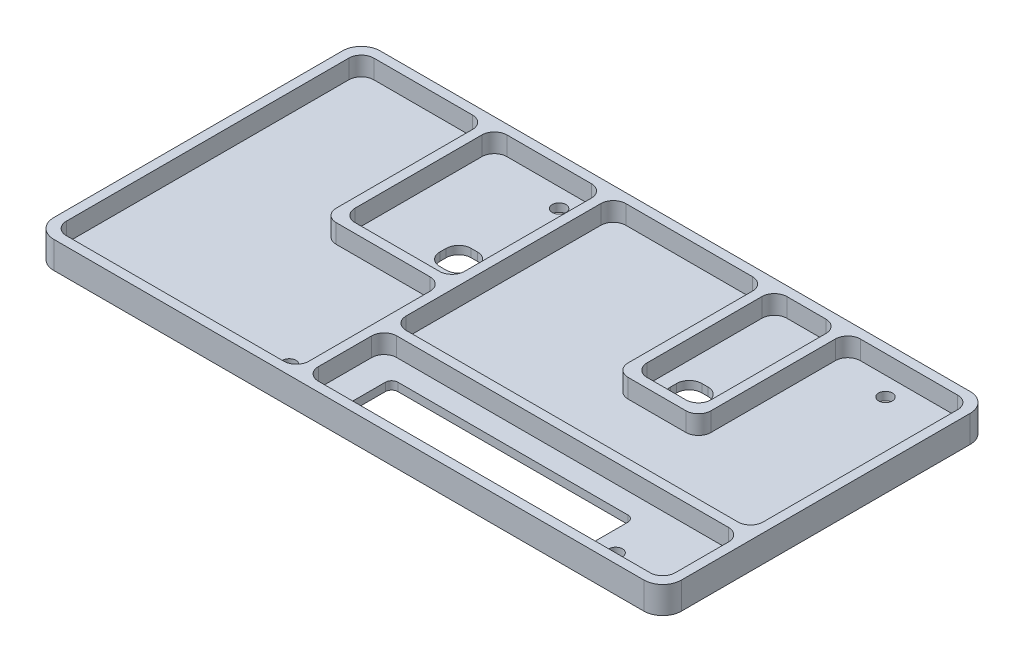
from build123d import *

# Parameters (mm, degrees)
SKETCH_1_W          = 100
SKETCH_1_H          = 52
EXTRUDE_1_DEPTH     = 8.6
SKETCH_2_W          = 97
SKETCH_2_H          = 49
CUT_EXTRUDE_1_DEPTH = 3
SKETCH_3_R          = 1.1
SKETCH_3_W          = 38.632034186
SKETCH_3_H          = 7.399361665
SKETCH_3_W_2        = 5
SKETCH_3_H_2        = 5
CUT_EXTRUDE_2_DEPTH = 61.603041755
FILLET_1_R          = 2
SKETCH_4_W          = 1.5
SKETCH_4_H          = 6.8
CUT_EXTRUDE_3_DEPTH = 1
SKETCH_5_W          = 97
SKETCH_5_H          = 49
CUT_EXTRUDE_4_DEPTH = 3
EXTRUDE_2_DEPTH     = 3
FILLET_2_R          = 3
FILLET_3_R          = 2
FILLET_5_R          = 1
SKETCH_9_W          = 52
SKETCH_9_H          = 4.3
CUT_EXTRUDE_5_DEPTH = 106.341399486


with BuildPart() as part:
    # 草图1 → 凸台-拉伸1 (new body)
    with BuildSketch(Plane(origin=(0, 0, 0), x_dir=(1, 0, 0), z_dir=(0, 1, 0))):
        with Locations((1.17145908, 5.982033169)):
            Rectangle(SKETCH_1_W, SKETCH_1_H)
    extrude(amount=EXTRUDE_1_DEPTH)

    # 草图2 → 切除-拉伸1 (cut)
    with BuildSketch(Plane.XZ):
        with Locations((1.17145908, -5.982033169)):
            Rectangle(SKETCH_2_W, SKETCH_2_H)
    extrude(amount=-CUT_EXTRUDE_1_DEPTH, mode=Mode.SUBTRACT)

    # 草图3 → 切除-拉伸2 (cut, through all)
    with BuildSketch(Plane.XZ.offset(-3)):
        with Locations(Location((-12.82854092, 15.517966831, 0), (0, 0, 270))):
            Circle(SKETCH_3_R)
        with Locations(Location((39.17145908, 15.517966831, 0), (0, 0, 270))):
            Circle(SKETCH_3_R)
        with Locations(Location((39.17145908, -27.482033169, 0), (0, 0, 270))):
            Circle(SKETCH_3_R)
        with Locations(Location((-12.82854092, -27.482033169, 0), (0, 0, 270))):
            Circle(SKETCH_3_R)
        with Locations((16.615396969, 13.018709543)):
            Rectangle(SKETCH_3_W, SKETCH_3_H)
        with Locations((-13.82854092, -12.482033169)):
            Rectangle(SKETCH_3_W_2, SKETCH_3_H_2)
        with Locations((23.17145908, -12.21289677)):
            Rectangle(SKETCH_3_W_2, SKETCH_3_H_2)
    extrude(amount=-CUT_EXTRUDE_2_DEPTH, mode=Mode.SUBTRACT)

    # 圆角1
    fillet_1_edges = [part.edges().sort_by_distance(p)[0] for p in [
        (20.67145908, 5.8, -14.71289677),
        (20.67145908, 5.8, -9.71289677),
        (25.67145908, 5.8, -9.71289677),
        (25.67145908, 5.8, -14.71289677),
        (-16.32854092, 5.8, -14.982033169),
        (-16.32854092, 5.8, -9.982033169),
        (-11.32854092, 5.8, -9.982033169),
        (-11.32854092, 5.8, -14.982033169),
    ]]
    fillet(fillet_1_edges, radius=FILLET_1_R)

    # 草图4 → 切除-拉伸3 (cut)
    with BuildSketch(Plane.XZ):
        with Locations((50.42145908, 0.917966831)):
            Rectangle(SKETCH_4_W, SKETCH_4_H)
    extrude(amount=-CUT_EXTRUDE_3_DEPTH, mode=Mode.SUBTRACT)

    # 草图5 → 切除-拉伸4 (cut)
    with BuildSketch(Plane(origin=(0, 8.6, 0), x_dir=(1, 0, 0), z_dir=(0, 1, 0))):
        with Locations((1.17145908, 5.982033169)):
            Rectangle(SKETCH_5_W, SKETCH_5_H)
    extrude(amount=-CUT_EXTRUDE_4_DEPTH, mode=Mode.SUBTRACT)

    # 草图7 → 凸台-拉伸2 (add, through all)
    with BuildSketch(Plane(origin=(0, 5.6, 0), x_dir=(1, 0, 0), z_dir=(0, 1, 0))):
        Polygon((-8.68854092, -18.517966831), (-8.68854092, 4.782033169), (-27.62854092, 4.782033169), (-27.62854092, 30.482033169), (-26.12854092, 30.482033169), (-26.12854092, 6.282033169), (-8.68854092, 6.282033169), (-8.68854092, 30.482033169), (-7.18854092, 30.482033169), (-7.18854092, -4.517966831), (49.67145908, -4.517966831), (49.67145908, -6.017966831), (-7.18854092, -6.017966831), (-7.18854092, -18.517966831), align=None)
        Polygon((16.97145908, 30.482033169), (16.97145908, 6.682033169), (30.17145908, 6.682033169), (30.17145908, 30.482033169), (28.67145908, 30.482033169), (28.67145908, 8.182033169), (18.47145908, 8.182033169), (18.47145908, 30.482033169), align=None)
    extrude(amount=EXTRUDE_2_DEPTH)

    # 圆角2
    fillet_2_edges = [part.edges().sort_by_distance(p)[0] for p in [
        (-48.82854092, 4.3, -31.982033169),
        (51.17145908, 4.3, -31.982033169),
        (51.17145908, 4.3, 20.017966831),
        (-48.82854092, 4.3, 20.017966831),
    ]]
    fillet(fillet_2_edges, radius=FILLET_2_R)

    # 圆角3
    fillet_3_edges = [part.edges().sort_by_distance(p)[0] for p in [
        (49.67145908, 1.5, 18.517966831),
        (49.67145908, 1.5, -30.482033169),
        (-47.32854092, 1.5, -30.482033169),
        (-47.32854092, 1.5, 18.517966831),
        (-47.32854092, 7.1, 18.517966831),
        (-47.32854092, 7.1, -30.482033169),
        (49.67145908, 7.1, -30.482033169),
        (49.67145908, 7.1, 18.517966831),
        (-8.68854092, 7.1, 18.517966831),
        (-7.18854092, 7.1, 18.517966831),
        (-7.18854092, 7.1, 6.017966831),
        (49.67145908, 7.1, 6.017966831),
        (49.67145908, 7.1, 4.517966831),
        (-7.18854092, 7.1, 4.517966831),
        (-7.18854092, 7.1, -30.482033169),
        (-8.68854092, 7.1, -30.482033169),
        (-8.68854092, 7.1, -6.282033169),
        (-26.12854092, 7.1, -6.282033169),
        (-26.12854092, 7.1, -30.482033169),
        (-27.62854092, 7.1, -30.482033169),
        (-27.62854092, 7.1, -4.782033169),
        (-8.68854092, 7.1, -4.782033169),
        (18.47145908, 7.1, -30.482033169),
        (16.97145908, 7.1, -30.482033169),
        (16.97145908, 7.1, -6.682033169),
        (30.17145908, 7.1, -6.682033169),
        (30.17145908, 7.1, -30.482033169),
        (28.67145908, 7.1, -30.482033169),
        (28.67145908, 7.1, -8.182033169),
        (18.47145908, 7.1, -8.182033169),
    ]]
    fillet(fillet_3_edges, radius=FILLET_3_R)

    # 圆角5
    fillet_5_edges = [part.edges().sort_by_distance(p)[0] for p in [
        (-2.700620124, 4.3, 16.718390375),
        (35.931414062, 4.3, 16.718390375),
        (-2.700620124, 4.3, 9.31902871),
        (35.931414062, 4.3, 9.31902871),
    ]]
    fillet(fillet_5_edges, radius=FILLET_5_R)

    # 草图9 → 切除-拉伸5 (cut, through all)
    with BuildSketch(Plane(origin=(51.17145908, 0, 0), x_dir=(0, 0, -1), z_dir=(1, 0, 0))):
        with Locations((5.982033169, 2.15)):
            Rectangle(SKETCH_9_W, SKETCH_9_H)
    extrude(amount=-CUT_EXTRUDE_5_DEPTH, mode=Mode.SUBTRACT)


solid = part.part
